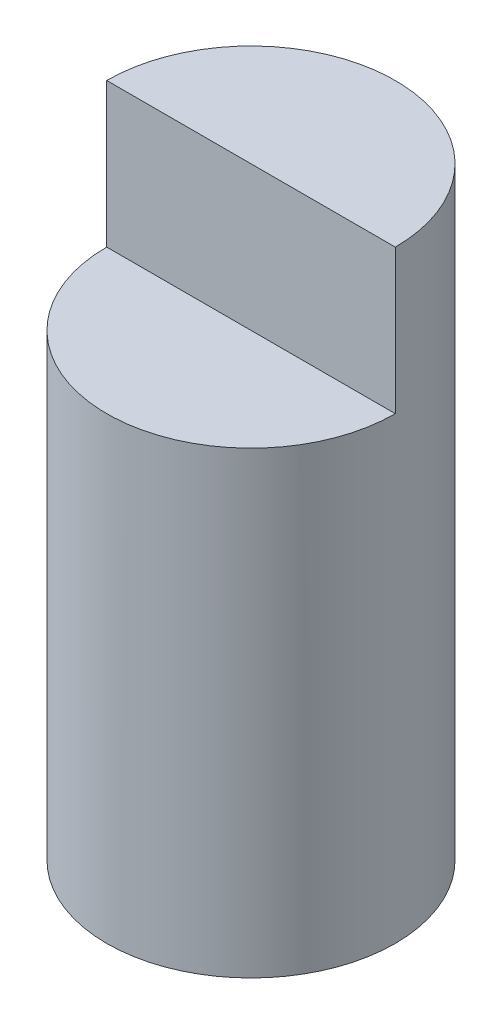
from build123d import *

# Parameters (mm, degrees)
SKETCH1_R                = 3.175
BOSS_EXTRUDE1_DEPTH      = 13.2715
SKETCH2_W                = 6.35
SKETCH2_H                = 4.534297592
CLEAR_LCD_FASTENER_DEPTH = 3.175
SKETCH3_R                = 1.27
TAP_NUMBER_4_DEPTH       = 8.509


with BuildPart() as part:
    # Sketch1 → Boss-Extrude1 (new body)
    with BuildSketch(Plane(origin=(0, 0, 0), x_dir=(1, 0, 0), z_dir=(0, 1, 0))):
        with Locations(Location((25.040432804, 11.35730315, 0), (0, 0, 90))):
            Circle(SKETCH1_R)
    extrude(amount=BOSS_EXTRUDE1_DEPTH)

    # Sketch2 → clear LCD fastener (cut)
    with BuildSketch(Plane(origin=(0, 13.2715, 0), x_dir=(1, 0, 0), z_dir=(0, 1, 0))):
        with Locations((25.040432804, 9.090154354)):
            Rectangle(SKETCH2_W, SKETCH2_H)
    extrude(amount=-CLEAR_LCD_FASTENER_DEPTH, mode=Mode.SUBTRACT)

    # Sketch3 → tap number 4 (cut)
    with BuildSketch(Plane.XZ):
        with Locations(Location((25.040432804, -11.35730315, 0), (0, 0, 270))):
            Circle(SKETCH3_R)
    extrude(amount=-TAP_NUMBER_4_DEPTH, mode=Mode.SUBTRACT)


solid = part.part
